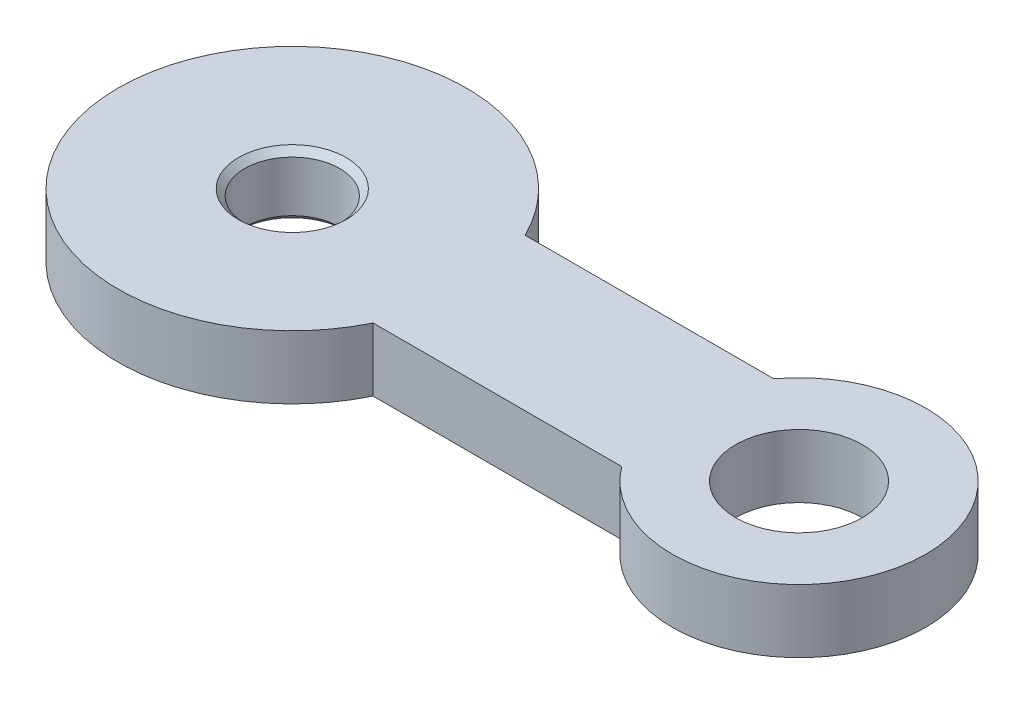
from build123d import *

# Parameters (mm, degrees)
SKETCH1_R           = 9.525
SKETCH1_R_2         = 12.7
BOSS_EXTRUDE1_DEPTH = 12.7
CHAMFER1_SIZE       = 1.27


with BuildPart() as part:
    # Sketch1 → Boss-Extrude1 (new body)
    with BuildSketch(Plane(origin=(0, 0, 0), x_dir=(1, 0, 0), z_dir=(0, 1, 0))):
        with BuildLine():
            Line((31.4244813, 15.24), (81.28, 15.24))
            ThreePointArc((81.28, 15.24), (127, 0), (81.28, -15.24))
            Line((81.28, -15.24), (31.4244813, -15.24))
            ThreePointArc((31.4244813, -15.24), (-34.925, 0), (31.4244813, 15.24))
        make_face()
        with Locations(Location((0, 0, 0), (0, 0, 270))):
            Circle(SKETCH1_R, mode=Mode.SUBTRACT)
        with Locations(Location((101.6, 0, 0), (0, 0, 270))):
            Circle(SKETCH1_R_2, mode=Mode.SUBTRACT)
    extrude(amount=BOSS_EXTRUDE1_DEPTH)

    # Chamfer1
    chamfer1_edges = [part.edges().sort_by_distance(p)[0] for p in [
        (0, 0, -9.525),
        (0, 12.7, -9.525),
    ]]
    chamfer(chamfer1_edges, length=CHAMFER1_SIZE)


solid = part.part
